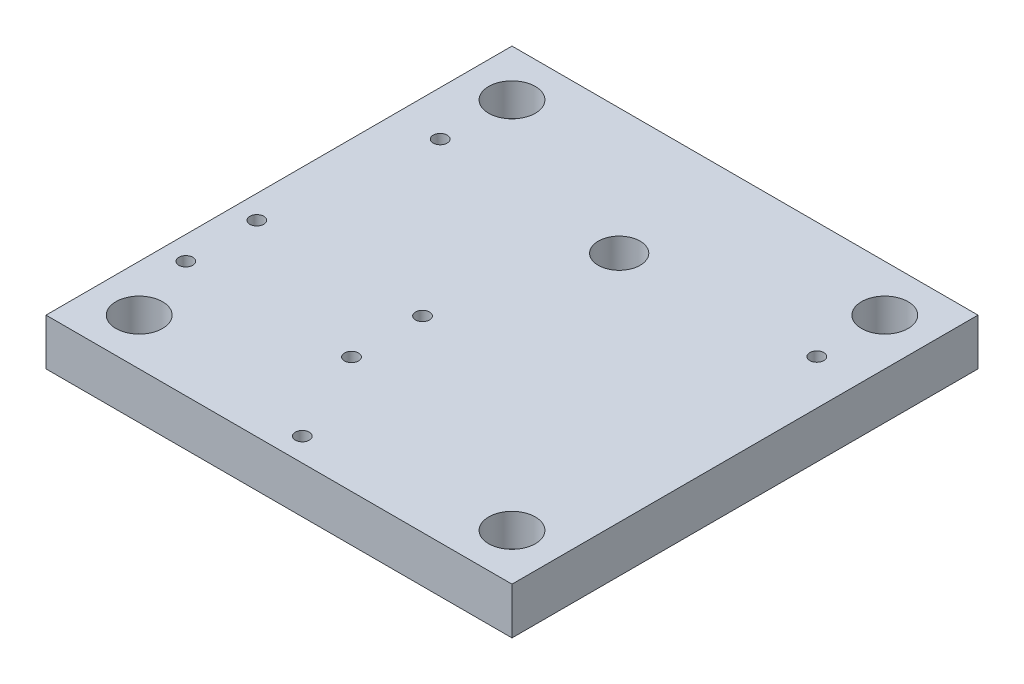
from build123d import *

# Parameters (mm, degrees)
SKETCH_1_W          = 100
SKETCH_1_H          = 100
EXTRUDE_1_DEPTH     = 10
SKETCH_2_R          = 5
CUT_EXTRUDE_1_DEPTH = 7
SKETCH_3_R          = 1.5
CUT_EXTRUDE_2_DEPTH = 142.774468788
SKETCH_4_R          = 4.5
CUT_EXTRUDE_3_DEPTH = 142.774468788
SKETCH_5_R          = 6.5
CUT_EXTRUDE_4_DEPTH = 3
SKETCH_6_R          = 1.5
CUT_EXTRUDE_5_DEPTH = 142.774468788
SKETCH_7_R          = 1.4
CUT_EXTRUDE_6_DEPTH = 5


with BuildPart() as part:
    # 草图1 → 凸台-拉伸1 (new body)
    with BuildSketch(Plane(origin=(0, 0, 0), x_dir=(1, 0, 0), z_dir=(0, 1, 0))):
        with Locations((50, -50)):
            Rectangle(SKETCH_1_W, SKETCH_1_H)
    extrude(amount=EXTRUDE_1_DEPTH)

    # 草图2 → 切除-拉伸1 (cut)
    with BuildSketch(Plane(origin=(0, 10, 0), x_dir=(1, 0, 0), z_dir=(0, 1, 0))):
        with Locations(Location((10, -10, 0), (0, 0, 270))):
            Circle(SKETCH_2_R)
        with Locations(Location((90, -10, 0), (0, 0, 270))):
            Circle(SKETCH_2_R)
        with Locations(Location((10, -90, 0), (0, 0, 270))):
            Circle(SKETCH_2_R)
        with Locations(Location((90, -90, 0), (0, 0, 270))):
            Circle(SKETCH_2_R)
    extrude(amount=-CUT_EXTRUDE_1_DEPTH, mode=Mode.SUBTRACT)

    # 草图3 → 切除-拉伸2 (cut, through all)
    with BuildSketch(Plane(origin=(0, 10, 0), x_dir=(1, 0, 0), z_dir=(0, 1, 0))):
        with Locations(Location((50, -95, 0), (0, 0, 270))):
            Circle(SKETCH_3_R)
        with Locations(Location((90.414518843, -25, 0), (0, 0, 270))):
            Circle(SKETCH_3_R)
        with Locations(Location((9.585481157, -25, 0), (0, 0, 270))):
            Circle(SKETCH_3_R)
    extrude(amount=-CUT_EXTRUDE_2_DEPTH, mode=Mode.SUBTRACT)

    # 草图4 → 切除-拉伸3 (cut, through all)
    with BuildSketch(Plane(origin=(0, 10, 0), x_dir=(1, 0, 0), z_dir=(0, 1, 0))):
        with Locations(Location((50, -27, 0), (0, 0, 270))):
            Circle(SKETCH_4_R)
    extrude(amount=-CUT_EXTRUDE_3_DEPTH, mode=Mode.SUBTRACT)

    # 草图5 → 切除-拉伸4 (cut)
    with BuildSketch(Plane(origin=(0, 0, 0), x_dir=(-1, 0, 0), z_dir=(0, -1, 0))):
        with Locations(Location((-50, -27, 0), (0, 0, 90))):
            Circle(SKETCH_5_R)
    extrude(amount=-CUT_EXTRUDE_4_DEPTH, mode=Mode.SUBTRACT)

    # 草图6 → 切除-拉伸5 (cut, through all)
    with BuildSketch(Plane(origin=(0, 10, 0), x_dir=(1, 0, 0), z_dir=(0, 1, 0))):
        with Locations(Location((40.56, -59.76, 0), (0, 0, 270))):
            Circle(SKETCH_6_R)
        with Locations(Location((40.56, -75, 0), (0, 0, 270))):
            Circle(SKETCH_6_R)
        with Locations(Location((5, -59.76, 0), (0, 0, 270))):
            Circle(SKETCH_6_R)
        with Locations(Location((5, -75, 0), (0, 0, 270))):
            Circle(SKETCH_6_R)
    extrude(amount=-CUT_EXTRUDE_5_DEPTH, mode=Mode.SUBTRACT)

    # 草图7 → 切除-拉伸6 (cut)
    with BuildSketch(Plane(origin=(0, 0, 0), x_dir=(-1, 0, 0), z_dir=(0, -1, 0))):
        with Locations(Location((-65, -27, 0), (0, 0, 90))):
            Circle(SKETCH_7_R)
        with Locations(Location((-35, -27, 0), (0, 0, 90))):
            Circle(SKETCH_7_R)
    extrude(amount=-CUT_EXTRUDE_6_DEPTH, mode=Mode.SUBTRACT)


solid = part.part
